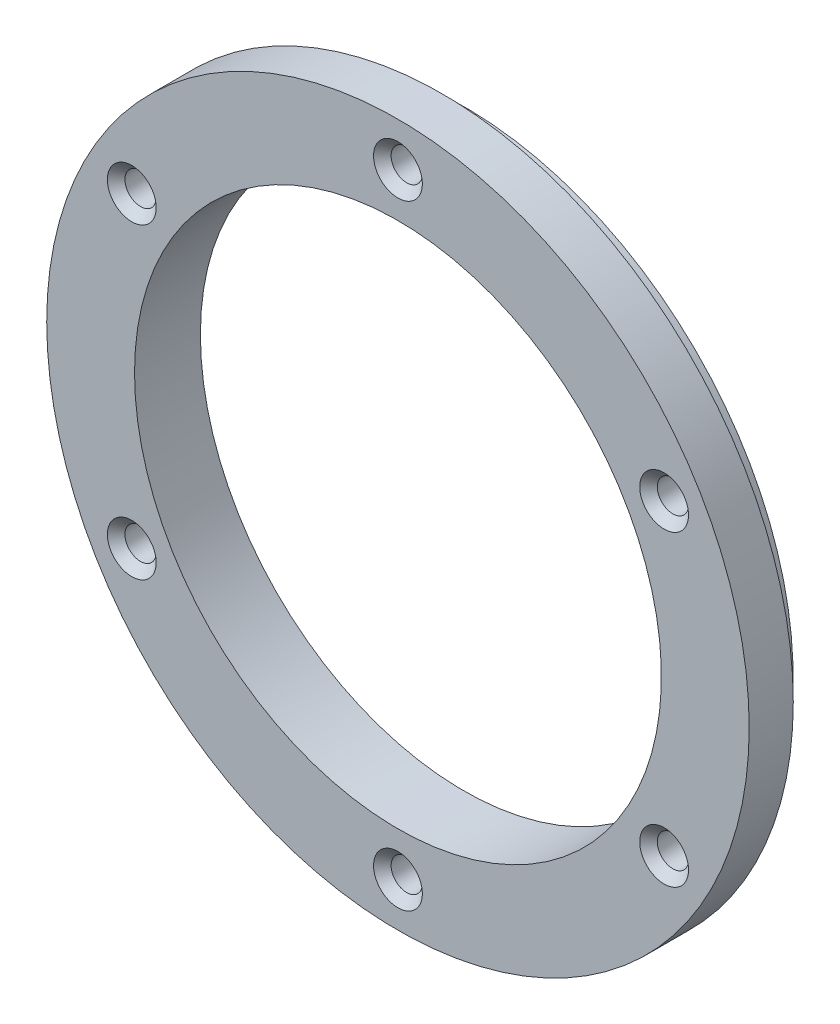
from build123d import *

# Parameters (mm, degrees)
SKETCH1_R                       = 25.4
SKETCH1_R_2                     = 19.05
BOSS_EXTRUDE1_DEPTH             = 4.7625
F_4_40_TAPPED_HOLE1_D           = 2.2606
F_4_40_TAPPED_HOLE1_DEPTH       = 7.62
F_4_40_TAPPED_HOLE1_CSINK_D     = 3.5306
F_4_40_TAPPED_HOLE1_CSINK_ANGLE = 90
F_4_40_TAPPED_HOLE1_TIP         = 0.679152758
SKETCH5_OUTSIDE_W               = 67.2
SKETCH5_OUTSIDE_H               = 67.2
SKETCH5_OUTSIDE_R               = 23.8125
CUT_EXTRUDE1_DEPTH              = 1.5748


with BuildPart() as part:
    # Sketch1 → Boss-Extrude1 (new body)
    with BuildSketch(Plane.XY):
        with Locations(Location((0, 0, 0), (0, 0, 180))):
            Circle(SKETCH1_R)
        with Locations(Location((0, 0, 0), (0, 0, 180))):
            Circle(SKETCH1_R_2, mode=Mode.SUBTRACT)
    extrude(amount=BOSS_EXTRUDE1_DEPTH)

    # #4-40 Tapped Hole1
    with Locations(Plane.XY.offset(4.7625)):
        with Locations((0, 22.225), (-19.247414599, 11.1125), (19.247414599, 11.1125), (19.247414599, -11.1125), (0, -22.225), (-19.247414599, -11.1125)):
            CounterSinkHole(F_4_40_TAPPED_HOLE1_D / 2, F_4_40_TAPPED_HOLE1_CSINK_D / 2, depth=F_4_40_TAPPED_HOLE1_DEPTH, counter_sink_angle=F_4_40_TAPPED_HOLE1_CSINK_ANGLE)
            with Locations((0, 0, -(F_4_40_TAPPED_HOLE1_DEPTH + F_4_40_TAPPED_HOLE1_TIP / 2))):  # 118° drill point
                Cone(0, F_4_40_TAPPED_HOLE1_D / 2, F_4_40_TAPPED_HOLE1_TIP, mode=Mode.SUBTRACT)

    # Sketch5 outside → Cut-Extrude1 (cut)
    with BuildSketch(Plane(origin=(0, 0, 0), x_dir=(-1, 0, 0), z_dir=(0, 0, -1))):
        Rectangle(SKETCH5_OUTSIDE_W, SKETCH5_OUTSIDE_H)
        Circle(SKETCH5_OUTSIDE_R, mode=Mode.SUBTRACT)
    extrude(amount=-CUT_EXTRUDE1_DEPTH, mode=Mode.SUBTRACT)


solid = part.part
